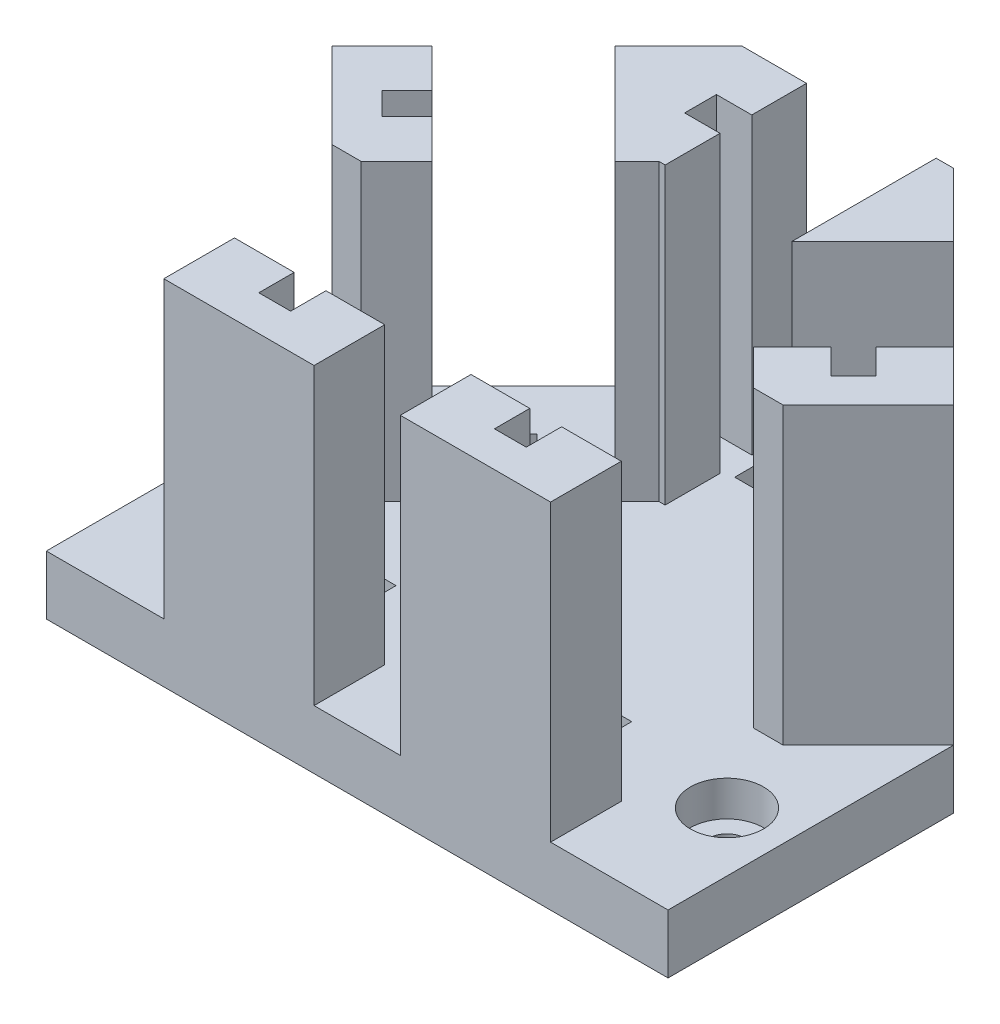
from build123d import *

# Parameters (mm, degrees)
BOSS_EXTRUDE1_DEPTH   = 25
BOSS_EXTRUDE1_2_DEPTH = 25
BOSS_EXTRUDE1_3_DEPTH = 25
BOSS_EXTRUDE1_4_DEPTH = 25
BOSS_EXTRUDE1_5_DEPTH = 25
BOSS_EXTRUDE1_6_DEPTH = 25
BOSS_EXTRUDE2_DEPTH   = 5
SKETCH3_R             = 1.55
SKETCH3_W             = 5.4
SKETCH3_H             = 2
SKETCH3_W_2           = 2
SKETCH3_H_2           = 5.4
CUT_EXTRUDE1_DEPTH    = 5
SKETCH4_R             = 3.1
CUT_EXTRUDE2_DEPTH    = 3


with BuildPart() as part:
    # Sketch1 → Boss-Extrude1 (new body)
    with BuildSketch(Plane(origin=(0, 0, 0), x_dir=(1, 0, 0), z_dir=(0, 1, 0))):
        Polygon((-26.02081528, -11.763455967), (-19.142135624, -18.642135624), (-16.656854249, -18.642135624), (-13.656854249, -15.642135624), (-15.778174593, -13.52081528), (-16.944900782, -12.354089091), (-19.066221126, -14.475409435), (-20.02081528, -13.52081528), (-20.975409435, -12.566221126), (-18.854089091, -10.444900782), (-20.02081528, -9.278174593), (-22.142135624, -7.156854249), (-26.384776311, -11.399494937), align=None)
    extrude(amount=BOSS_EXTRUDE1_DEPTH)



with BuildPart() as body_2:
    # Sketch1 → Boss-Extrude1 2 (new body)
    with BuildSketch(Plane(origin=(0, 0, 0), x_dir=(1, 0, 0), z_dir=(0, 1, 0))):
        Polygon((-3.5, 3), (-3.5, 5.996116817), (-8.989164557, 5.996116817), (-14.363961031, 0.621320344), (-5.878679656, -7.863961031), (-4.018601808, -6.003883183), (-3.5, -6.003883183), (-3.5, -3), (-3.5, -1.35), (-6.5, -1.35), (-6.5, 1.35), (-3.5, 1.35), align=None)
    extrude(amount=BOSS_EXTRUDE1_2_DEPTH)


with BuildPart() as body_3:
    # Sketch1 → Boss-Extrude1 3 (new body)
    with BuildSketch(Plane(origin=(0, 0, 0), x_dir=(1, 0, 0), z_dir=(0, 1, 0))):
        Polygon((-10, -32.642135624), (-11.35, -32.642135624), (-11.35, -29.642135624), (-13.414613988, -29.642135624), (-16.414613988, -29.642135624), (-16.414613988, -35.642135624), (-3.660835443, -35.642135624), (-3.660835443, -29.642135624), (-6.660835443, -29.642135624), (-8.65, -29.642135624), (-8.65, -32.642135624), align=None)
    extrude(amount=BOSS_EXTRUDE1_3_DEPTH)


with BuildPart() as body_4:
    # Sketch1 → Boss-Extrude1 4 (new body)
    with BuildSketch(Plane(origin=(0, 0, 0), x_dir=(1, 0, 0), z_dir=(0, 1, 0))):
        Polygon((7.5, 5.996116817), (7.5, -6.242640687), (14.363961031, 0.621320344), (8.989164557, 5.996116817), align=None)
    extrude(amount=BOSS_EXTRUDE1_4_DEPTH)


with BuildPart() as body_5:
    # Sketch1 → Boss-Extrude1 5 (new body)
    with BuildSketch(Plane(origin=(0, 0, 0), x_dir=(1, 0, 0), z_dir=(0, 1, 0))):
        Polygon((16.944900782, -12.354089091), (19.066221126, -14.475409435), (20.02081528, -13.52081528), (20.975409435, -12.566221126), (18.854089091, -10.444900782), (20.02081528, -9.278174593), (22.142135624, -7.156854249), (26.384776311, -11.399494937), (26.02081528, -11.763455967), (19.142135624, -18.642135624), (16.656854249, -18.642135624), (13.656854249, -15.642135624), (15.778174593, -13.52081528), align=None)
    extrude(amount=BOSS_EXTRUDE1_5_DEPTH)


with BuildPart() as body_6:
    # Sketch1 → Boss-Extrude1 6 (new body)
    with BuildSketch(Plane(origin=(0, 0, 0), x_dir=(1, 0, 0), z_dir=(0, 1, 0))):
        Polygon((8.65, -29.642135624), (8.65, -32.642135624), (10, -32.642135624), (11.35, -32.642135624), (11.35, -29.642135624), (13.414613988, -29.642135624), (16.414613988, -29.642135624), (16.414613988, -35.642135624), (3.660835443, -35.642135624), (3.660835443, -29.642135624), (6.660835443, -29.642135624), align=None)
    extrude(amount=BOSS_EXTRUDE1_6_DEPTH)


with BuildPart() as part_1:
    add(part.part)

    add(body_2.part)  # Boss-Extrude2 merges body 2

    add(body_3.part)  # Boss-Extrude2 merges body 3

    add(body_4.part)  # Boss-Extrude2 merges body 4

    add(body_5.part)  # Boss-Extrude2 merges body 5

    add(body_6.part)  # Boss-Extrude2 merges body 6
    # Sketch2 → Boss-Extrude2 (add)
    with BuildSketch(Plane(origin=(0, 0, 0), x_dir=(-1, 0, 0), z_dir=(0, -1, 0))):
        Polygon((-26.384776311, -11.399494937), (-8.989164557, 5.996116817), (8.989164557, 5.996116817), (26.384776311, -11.399494937), (26.384776311, -35.642135624), (-16.414613988, -35.642135624), (-26.384776311, -35.642135624), align=None)
    extrude(amount=BOSS_EXTRUDE2_DEPTH)

    # Sketch3 → Cut-Extrude1 (cut)
    with BuildSketch(Plane(origin=(0, 0, 0), x_dir=(1, 0, 0), z_dir=(0, 1, 0))):
        with Locations(Location((-21.384776311, -25.642135624, 0), (0, 0, 270))):
            Circle(SKETCH3_R)
        with Locations(Location((0, -23.642135624, 0), (0, 0, 270))):
            Circle(SKETCH3_R)
        with Locations(Location((21.384776311, -25.642135624, 0), (0, 0, 90))):
            Circle(SKETCH3_R)
        with Locations((0.1, 0)):
            Rectangle(SKETCH3_W, SKETCH3_H)
        Polygon((-17.970205615, -10.055992052), (-16.555992052, -11.470205615), (-12.737615434, -7.651828996), (-14.151828996, -6.237615434), align=None)
        with Locations((10, -26.042135624)):
            Rectangle(SKETCH3_W_2, SKETCH3_H_2)
        with Locations((-10, -26.042135624)):
            Rectangle(SKETCH3_W_2, SKETCH3_H_2)
        Polygon((12.737615434, -7.651828996), (14.151828996, -6.237615434), (17.970205615, -10.055992052), (16.555992052, -11.470205615), align=None)
    extrude(amount=-CUT_EXTRUDE1_DEPTH, mode=Mode.SUBTRACT)

    # Sketch4 → Cut-Extrude2 (cut)
    with BuildSketch(Plane(origin=(0, 0, 0), x_dir=(1, 0, 0), z_dir=(0, 1, 0))):
        with Locations(Location((-21.384776311, -25.642135624, 0), (0, 0, 270))):
            Circle(SKETCH4_R)
        with Locations(Location((0, -23.642135624, 0), (0, 0, 270))):
            Circle(SKETCH4_R)
        with Locations(Location((21.384776311, -25.642135624, 0), (0, 0, 270))):
            Circle(SKETCH4_R)
    extrude(amount=-CUT_EXTRUDE2_DEPTH, mode=Mode.SUBTRACT)


solid = part_1.part
